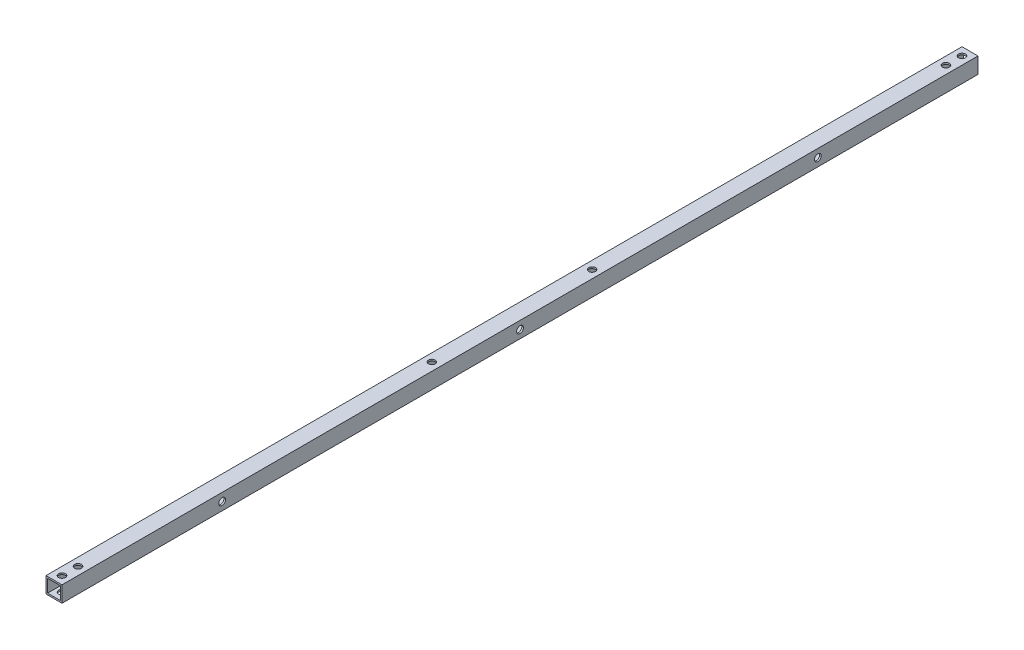
from build123d import *

# Parameters (mm, degrees)
SKETCH1_W           = 10
SKETCH1_H           = 10
SKETCH1_W_2         = 8
SKETCH1_H_2         = 8
BOSS_EXTRUDE1_DEPTH = 572
SKETCH2_R           = 2.125
CUT_EXTRUDE1_DEPTH  = 116
SKETCH3_R           = 2.1
SKETCH3_R_2         = 2.125
CUT_EXTRUDE2_DEPTH  = 10
SKETCH5_R           = 2.125
CUT_EXTRUDE3_DEPTH  = 10


with BuildPart() as part:
    # Sketch1 → Boss-Extrude1 (new body)
    with BuildSketch(Plane.XY):
        with Locations((5, 5)):
            Rectangle(SKETCH1_W, SKETCH1_H)
        with Locations((5, 5)):
            Rectangle(SKETCH1_W_2, SKETCH1_H_2, mode=Mode.SUBTRACT)
    extrude(amount=BOSS_EXTRUDE1_DEPTH)

    # Sketch2 → Cut-Extrude1 (cut)
    with BuildSketch(Plane(origin=(0, 10, 0), x_dir=(1, 0, 0), z_dir=(0, 1, 0))):
        with Locations(Location((5, -5, 0), (0, 0, 270))):
            Circle(SKETCH2_R)
        with Locations(Location((5, -15, 0), (0, 0, 270))):
            Circle(SKETCH2_R)
        with Locations(Location((5, -557, 0), (0, 0, 270))):
            Circle(SKETCH2_R)
        with Locations(Location((5, -567, 0), (0, 0, 270))):
            Circle(SKETCH2_R)
    extrude(amount=-CUT_EXTRUDE1_DEPTH, mode=Mode.SUBTRACT)

    # Sketch3 → Cut-Extrude2 (cut)
    with BuildSketch(Plane.XZ):
        with Locations(Location((5, 336, 0), (0, 0, 270))):
            Circle(SKETCH3_R)
        with Locations(Location((5, 236, 0), (0, 0, 270))):
            Circle(SKETCH3_R_2)
    extrude(amount=-CUT_EXTRUDE2_DEPTH, mode=Mode.SUBTRACT)

    # Sketch5 → Cut-Extrude3 (cut)
    with BuildSketch(Plane(origin=(10, 0, 0), x_dir=(0, 0, -1), z_dir=(1, 0, 0))):
        with Locations(Location((-472, 5, 0), (0, 0, 90))):
            Circle(SKETCH5_R)
        with Locations(Location((-100, 5, 0), (0, 0, 90))):
            Circle(SKETCH5_R)
        with Locations(Location((-286, 5, 0), (0, 0, 90))):
            Circle(SKETCH5_R)
    extrude(amount=-CUT_EXTRUDE3_DEPTH, mode=Mode.SUBTRACT)


solid = part.part
